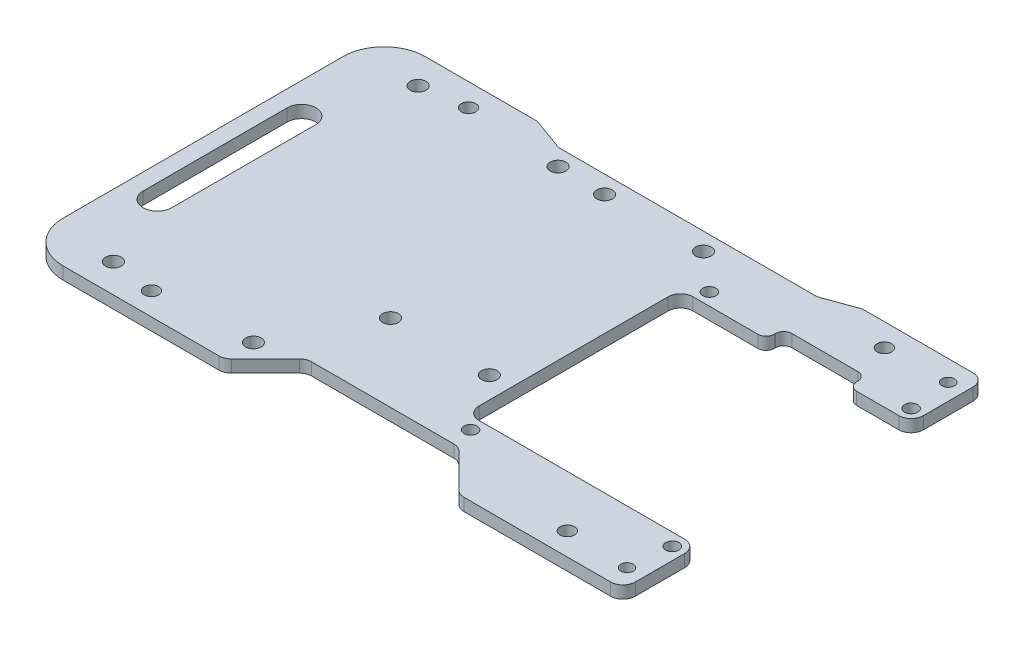
from build123d import *

# Parameters (mm, degrees)
SKETCH1_R           = 1.75
SKETCH1_R_2         = 1.6
SKETCH1_R_3         = 1.9
BOSS_EXTRUDE1_DEPTH = 3
FILLET1_R           = 3
FILLET2_R           = 7
FILLET3_R           = 2
SKETCH2_R           = 1.5
CUT_EXTRUDE1_DEPTH  = 10
SKETCH3_W           = 22.30502782
SKETCH3_H           = 95.515652082
CUT_EXTRUDE2_DEPTH  = 10
FILLET4_R           = 10


with BuildPart() as part:
    # Sketch1 → Boss-Extrude1 (new body)
    with BuildSketch(Plane(origin=(0, 0, 0), x_dir=(1, 0, 0), z_dir=(0, 1, 0))):
        Polygon((-75, -44), (-75, -35), (-71, -30), (-71, 30), (-75, 35), (-75, 44), (-33.772107485, 44), (-25.721646761, 41.069871925), (37.112185403, 41.069871925), (45.162646126, 44), (75, 44), (75, 26), (59.767610868, 26), (59.767610868, 30.277885673), (39.767610868, 30.277885673), (39.767610868, 26), (19, 26), (19, -26), (75, -26), (75, -44), (35.158160284, -44), (25.158160284, -34), (-11.841839716, -34), (-21.841839716, -44), align=None)
        with Locations(Location((-45, 38.5, 0), (0, 0, 270))):
            Circle(SKETCH1_R, mode=Mode.SUBTRACT)
        with Locations(Location((56, 38.5, 0), (0, 0, 270))):
            Circle(SKETCH1_R, mode=Mode.SUBTRACT)
        with Locations(Location((56, -38.5, 0), (0, 0, 270))):
            Circle(SKETCH1_R, mode=Mode.SUBTRACT)
        with Locations(Location((-45, -38.5, 0), (0, 0, 270))):
            Circle(SKETCH1_R, mode=Mode.SUBTRACT)
        with Locations(Location((23, 29, 0), (0, 0, 270))):
            Circle(SKETCH1_R_2, mode=Mode.SUBTRACT)
        with Locations(Location((72, 29, 0), (0, 0, 270))):
            Circle(SKETCH1_R_2, mode=Mode.SUBTRACT)
        with Locations(Location((72, -29, 0), (0, 0, 270))):
            Circle(SKETCH1_R_2, mode=Mode.SUBTRACT)
        with Locations(Location((23, -29, 0), (0, 0, 270))):
            Circle(SKETCH1_R_2, mode=Mode.SUBTRACT)
        with Locations(Location((-55.746480847, 37, 0), (0, 0, 270))):
            Circle(SKETCH1_R_3, mode=Mode.SUBTRACT)
        with Locations(Location((-10.235416983, 36.785886944, 0), (0, 0, 270))):
            Circle(SKETCH1_R_3, mode=Mode.SUBTRACT)
        with Locations(Location((13.764583017, 36.785886944, 0), (0, 0, 270))):
            Circle(SKETCH1_R_3, mode=Mode.SUBTRACT)
        with Locations(Location((13.764583017, -15.214113056, 0), (0, 0, 270))):
            Circle(SKETCH1_R_3, mode=Mode.SUBTRACT)
        with Locations(Location((-10.235416983, -15.214113056, 0), (0, 0, 270))):
            Circle(SKETCH1_R_3, mode=Mode.SUBTRACT)
        with Locations(Location((-55.746480847, -37, 0), (0, 0, 270))):
            Circle(SKETCH1_R_3, mode=Mode.SUBTRACT)
        with Locations(Location((-21.746480847, -37, 0), (0, 0, 270))):
            Circle(SKETCH1_R_3, mode=Mode.SUBTRACT)
        with Locations(Location((-21.746480847, 37, 0), (0, 0, 270))):
            Circle(SKETCH1_R_3, mode=Mode.SUBTRACT)
        with BuildLine():
            Line((-60, 16.45), (-60, -18.55))
            ThreePointArc((-60, -18.55), (-63.5, -22.05), (-67, -18.55))
            Line((-67, -18.55), (-67, 16.45))
            ThreePointArc((-67, 16.45), (-63.5, 19.95), (-60, 16.45))
        make_face(mode=Mode.SUBTRACT)
    extrude(amount=BOSS_EXTRUDE1_DEPTH)

    # Fillet1
    fillet1_edges = [part.edges().sort_by_distance(p)[0] for p in [
        (75, 1.5, -44),
        (75, 1.5, -26),
        (19, 1.5, -26),
        (19, 1.5, 26),
        (75, 1.5, 26),
        (75, 1.5, 44),
        (35.158160284, 1.5, 44),
        (25.158160284, 1.5, 34),
        (-11.841839716, 1.5, 34),
        (-21.841839716, 1.5, 44),
        (-75, 1.5, 44),
        (-75, 1.5, -44),
        (-33.772107485, 1.5, -44),
        (-25.721646761, 1.5, -41.069871925),
        (37.112185403, 1.5, -41.069871925),
        (45.162646126, 1.5, -44),
    ]]
    fillet(fillet1_edges, radius=FILLET1_R)

    # Fillet2
    fillet2_edges = [part.edges().sort_by_distance(p)[0] for p in [
        (-71, 1.5, 30),
        (-71, 1.5, -30),
    ]]
    fillet(fillet2_edges, radius=FILLET2_R)

    # Fillet3
    fillet3_edges = [part.edges().sort_by_distance(p)[0] for p in [
        (59.767610868, 1.5, -26),
        (59.767610868, 1.5, -30.277885673),
        (39.767610868, 1.5, -30.277885673),
        (39.767610868, 1.5, -26),
    ]]
    fillet(fillet3_edges, radius=FILLET3_R)

    # Sketch2 → Cut-Extrude1 (cut)
    with BuildSketch(Plane(origin=(0, 3, 0), x_dir=(1, 0, 0), z_dir=(0, 1, 0))):
        with Locations(Location((71, 39, 0), (0, 0, 270))):
            Circle(SKETCH2_R)
        with Locations(Location((71, -39, 0), (0, 0, 270))):
            Circle(SKETCH2_R)
    extrude(amount=-CUT_EXTRUDE1_DEPTH, mode=Mode.SUBTRACT)

    # Sketch3 → Cut-Extrude2 (cut)
    with BuildSketch(Plane(origin=(0, 3, 0), x_dir=(1, 0, 0), z_dir=(0, 1, 0))):
        with Locations((-82.15251391, 0)):
            Rectangle(SKETCH3_W, SKETCH3_H)
    extrude(amount=-CUT_EXTRUDE2_DEPTH, mode=Mode.SUBTRACT)

    # Fillet4
    fillet4_edges = [part.edges().sort_by_distance(p)[0] for p in [
        (-71, 1.5, -44),
        (-71, 1.5, 44),
    ]]
    fillet(fillet4_edges, radius=FILLET4_R)


solid = part.part
